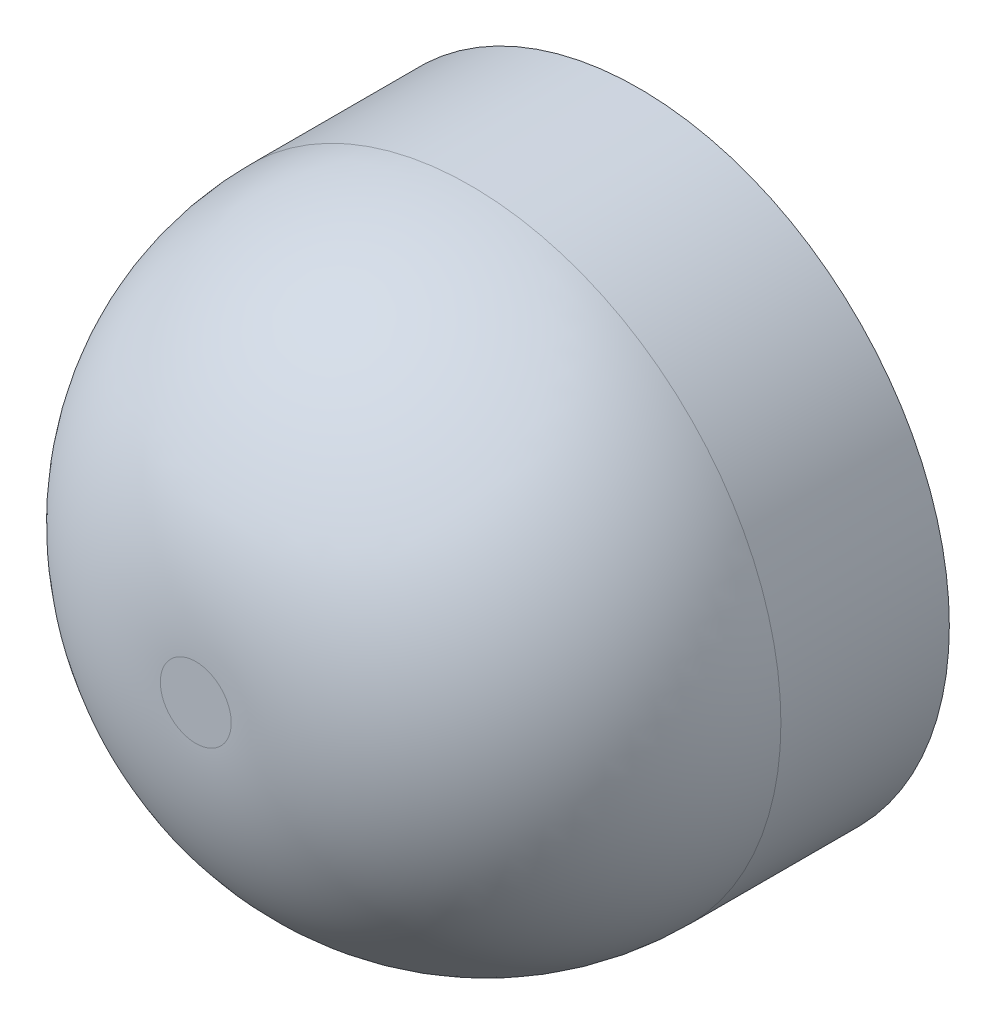
from build123d import *

# Parameters (mm, degrees)
CROQUIS1_R              = 3.5
SALIENTE_EXTRUIR1_DEPTH = 5
REDONDEO1_R             = 3.1


with BuildPart() as part:
    # Croquis1 → Saliente-Extruir1 (new body)
    with BuildSketch(Plane.XY):
        Circle(CROQUIS1_R)
    extrude(amount=SALIENTE_EXTRUIR1_DEPTH)

    # Redondeo1
    redondeo1_edges = [part.edges().sort_by_distance(p)[0] for p in [
        (-3.5, 0, 5),
    ]]
    fillet(redondeo1_edges, radius=REDONDEO1_R)


solid = part.part
